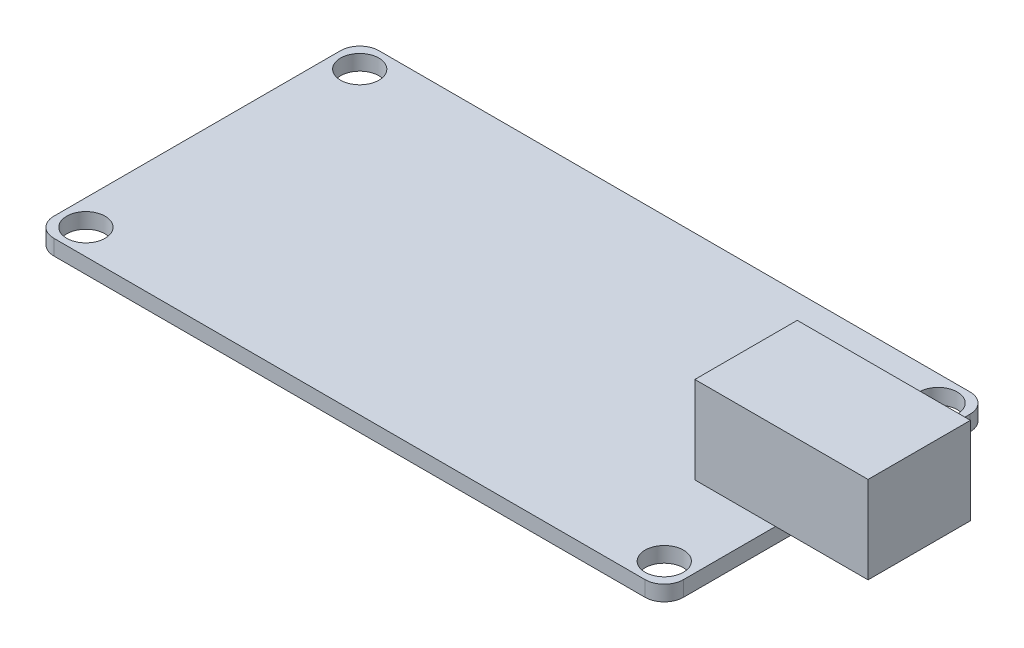
from build123d import *

# Parameters (mm, degrees)
ESQUISSE1_W        = 49.2
ESQUISSE1_H        = 25.4
ESQUISSE1_R        = 1.5
BOSS_EXTRU_1_DEPTH = 1.2
CONG_1_R           = 1.5
CONG_2_R           = 1.5
CONG_3_R           = 1.5
CONG_4_R           = 1.5
ESQUISSE3_W        = 13.534356754
ESQUISSE3_H        = 8
BOSS_EXTRU_2_DEPTH = 6.8


with BuildPart() as part:
    # Esquisse1 → Boss.-Extru.1 (new body)
    with BuildSketch(Plane(origin=(0, 0, 0), x_dir=(1, 0, 0), z_dir=(0, 1, 0))):
        Rectangle(ESQUISSE1_W, ESQUISSE1_H)
        with Locations(Location((22.6, 10.7, 0), (0, 0, 270))):
            Circle(ESQUISSE1_R, mode=Mode.SUBTRACT)
        with Locations(Location((22.6, -10.7, 0), (0, 0, 270))):
            Circle(ESQUISSE1_R, mode=Mode.SUBTRACT)
        with Locations(Location((-22.6, -10.7, 0), (0, 0, 270))):
            Circle(ESQUISSE1_R, mode=Mode.SUBTRACT)
        with Locations(Location((-22.6, 10.7, 0), (0, 0, 270))):
            Circle(ESQUISSE1_R, mode=Mode.SUBTRACT)
    extrude(amount=BOSS_EXTRU_1_DEPTH)

    # Congé1
    cong_1_edges = [part.edges().sort_by_distance(p)[0] for p in [
        (24.6, 0.6, 12.7),
    ]]
    fillet(cong_1_edges, radius=CONG_1_R)

    # Congé2
    cong_2_edges = [part.edges().sort_by_distance(p)[0] for p in [
        (-24.6, 0.6, 12.7),
    ]]
    fillet(cong_2_edges, radius=CONG_2_R)

    # Congé3
    cong_3_edges = [part.edges().sort_by_distance(p)[0] for p in [
        (24.6, 0.6, -12.7),
    ]]
    fillet(cong_3_edges, radius=CONG_3_R)

    # Congé4
    cong_4_edges = [part.edges().sort_by_distance(p)[0] for p in [
        (-24.6, 0.6, -12.7),
    ]]
    fillet(cong_4_edges, radius=CONG_4_R)

    # Esquisse3 → Boss.-Extru.2 (add)
    with BuildSketch(Plane(origin=(1.430842634, 1.2, 0.935550953), x_dir=(1, 0, 0), z_dir=(0, 1, 0))):
        with Locations((23.633586999, 0.928816864)):
            Rectangle(ESQUISSE3_W, ESQUISSE3_H)
    extrude(amount=BOSS_EXTRU_2_DEPTH)


solid = part.part
